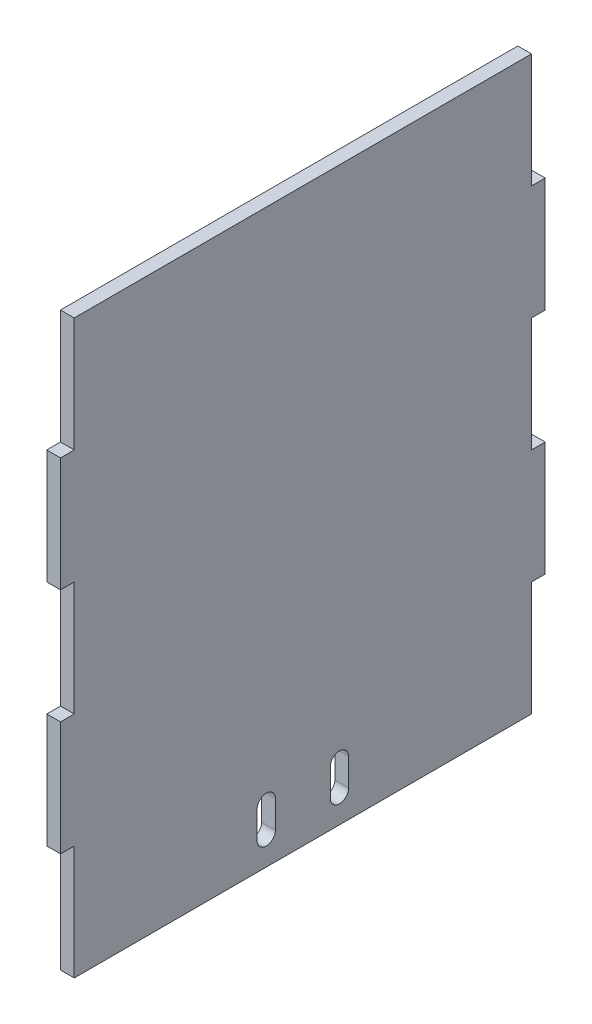
from build123d import *

# Parameters (mm, degrees)
SALIENTE_EXTRUIR1_DEPTH = 3
CORTAR_EXTRUIR1_DEPTH   = 3


with BuildPart() as part:
    # Croquis1 → Saliente-Extruir1 (new body)
    with BuildSketch(Plane(origin=(0, 0, 0), x_dir=(0, 0, -1), z_dir=(1, 0, 0))):
        Polygon((-46.517058898, 28.196284567), (53.482941102, 28.196284567), (53.482941102, 3.196284567), (56.482941102, 3.196284567), (56.482941102, -21.803715433), (53.482941102, -21.803715433), (53.482941102, -46.803715433), (56.482941102, -46.803715433), (56.482941102, -71.803715433), (53.482941102, -71.803715433), (53.482941102, -96.803715433), (-46.517058898, -96.803715433), (-46.517058898, -71.803715433), (-49.517058898, -71.803715433), (-49.517058898, -46.803715433), (-46.517058898, -46.803715433), (-46.517058898, -21.803715433), (-49.517058898, -21.803715433), (-49.517058898, 3.196284567), (-46.517058898, 3.196284567), align=None)
    extrude(amount=SALIENTE_EXTRUIR1_DEPTH)

    # Croquis2 → Cortar-Extruir1 (cut)
    with BuildSketch(Plane(origin=(3, 0, 0), x_dir=(0, 0, -1), z_dir=(1, 0, 0))):
        with BuildLine():
            Line((-6.517058898, -90.803715433), (-6.517058898, -84.803715433))
            ThreePointArc((-6.517058898, -84.803715433), (-4.517058898, -82.803715433), (-2.517058898, -84.803715433))
            Line((-2.517058898, -84.803715433), (-2.517058898, -90.803715433))
            ThreePointArc((-2.517058898, -90.803715433), (-4.517058898, -92.803715433), (-6.517058898, -90.803715433))
        make_face()
        with BuildLine():
            Line((13.482941102, -90.803715433), (13.482941102, -84.803715433))
            ThreePointArc((13.482941102, -84.803715433), (11.482941102, -82.803715433), (9.482941102, -84.803715433))
            Line((9.482941102, -84.803715433), (9.482941102, -90.803715433))
            ThreePointArc((9.482941102, -90.803715433), (11.482941102, -92.803715433), (13.482941102, -90.803715433))
        make_face()
    extrude(amount=-CORTAR_EXTRUIR1_DEPTH, mode=Mode.SUBTRACT)


solid = part.part
